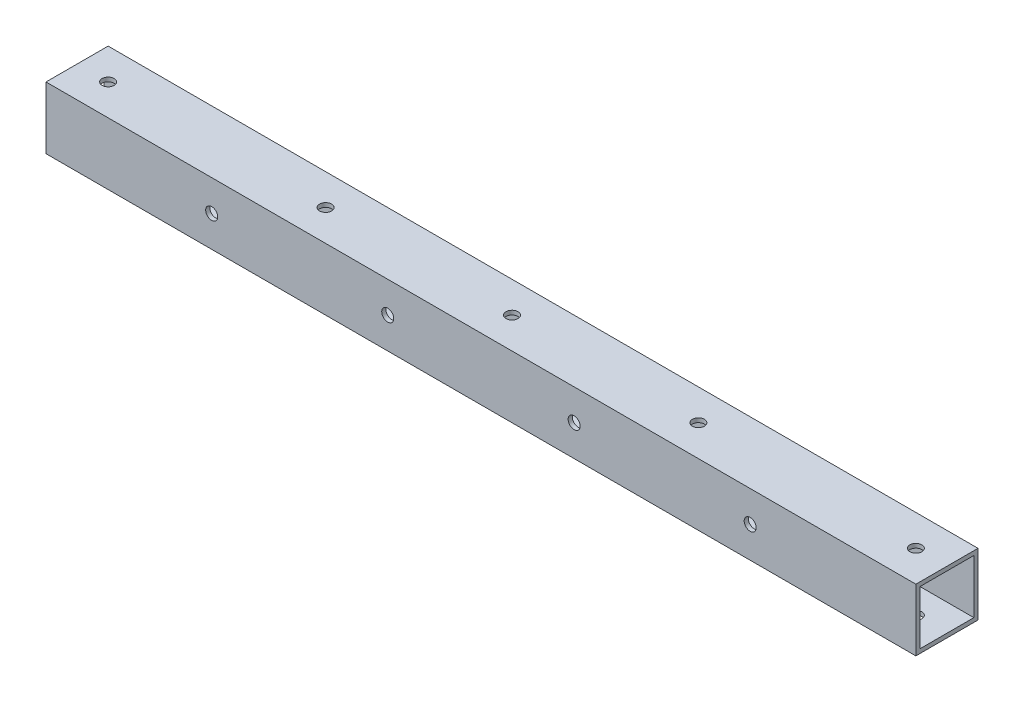
from build123d import *

# Parameters (mm, degrees)
SKETCH_11_W         = 15
SKETCH_11_H         = 15
SKETCH_11_W_2       = 13
SKETCH_11_H_2       = 13
F_15X15X1_1_DEPTH   = 210
SKETCH_12_R         = 1.45
CUT_EXTRUDE_1_DEPTH = 107.330851591
SKETCH_14_R         = 1.45
CUT_EXTRUDE_3_DEPTH = 107.330851591
SKETCH_15_R         = 1.45
CUT_EXTRUDE_4_DEPTH = 107.330851591


with BuildPart() as part:
    # 草图11 → 铝管 15X15X1(1) (new body)
    with BuildSketch(Plane(origin=(-105, 0, 0), x_dir=(0, 0, -1), z_dir=(1, 0, 0))):
        Rectangle(SKETCH_11_W, SKETCH_11_H)
        Rectangle(SKETCH_11_W_2, SKETCH_11_H_2, mode=Mode.SUBTRACT)
    extrude(amount=F_15X15X1_1_DEPTH)

    # 草图12 → 切除-拉伸1 (cut, through all)
    with BuildSketch(Plane(origin=(0, 0, -7.5), x_dir=(-1, 0, 0), z_dir=(0, 0, -1))):
        with Locations((22.5, 0)):
            Circle(SKETCH_12_R)
        with Locations((65, 0)):
            Circle(SKETCH_12_R)
        with Locations((-65, 0)):
            Circle(SKETCH_12_R)
        with Locations((-22.5, 0)):
            Circle(SKETCH_12_R)
    extrude(amount=-CUT_EXTRUDE_1_DEPTH, mode=Mode.SUBTRACT)

    # 草图14 → 切除-拉伸3 (cut, through all)
    with BuildSketch(Plane(origin=(0, 7.5, 0), x_dir=(1, 0, 0), z_dir=(0, 1, 0))):
        with Locations(Location((0, 0, 0), (0, 0, 270))):
            Circle(SKETCH_14_R)
        with Locations(Location((45, 0, 0), (0, 0, 270))):
            Circle(SKETCH_14_R)
        with Locations(Location((-45, 0, 0), (0, 0, 90))):
            Circle(SKETCH_14_R)
    extrude(amount=-CUT_EXTRUDE_3_DEPTH, mode=Mode.SUBTRACT)

    # 草图15 → 切除-拉伸4 (cut, through all)
    with BuildSketch(Plane.XZ.offset(7.5)):
        with Locations(Location((-97.5, 0, 0), (0, 0, 270))):
            Circle(SKETCH_15_R)
        with Locations(Location((97.5, 0, 0), (0, 0, 270))):
            Circle(SKETCH_15_R)
    extrude(amount=-CUT_EXTRUDE_4_DEPTH, mode=Mode.SUBTRACT)


solid = part.part
